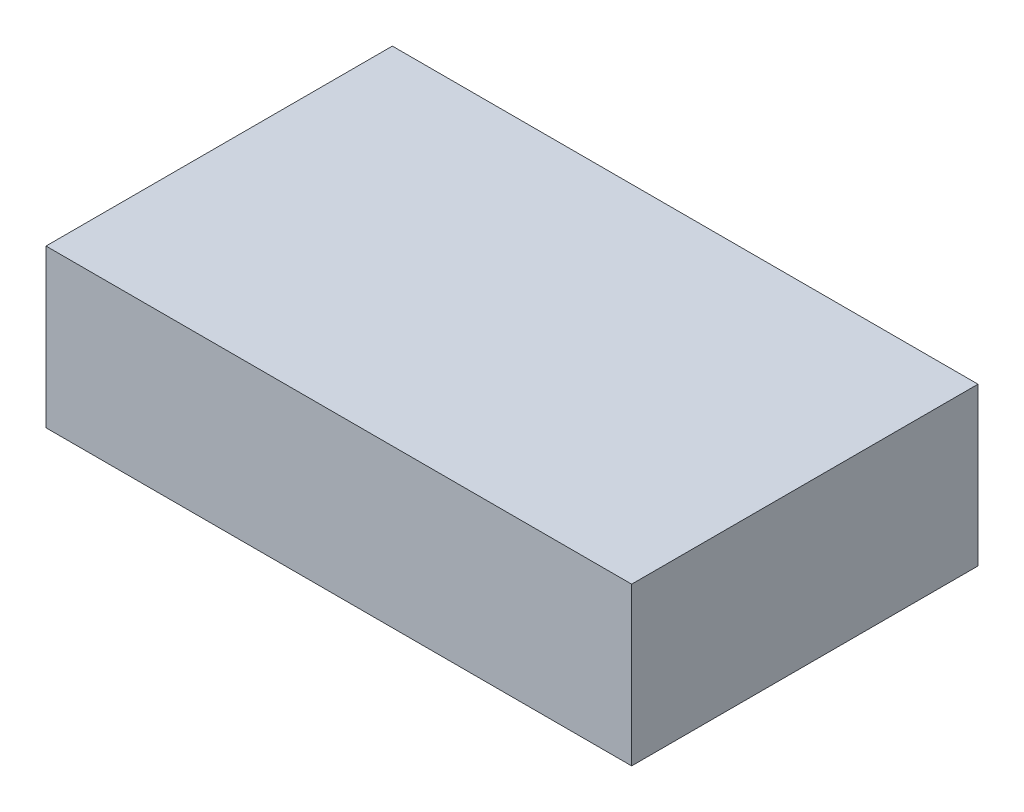
from build123d import *

# Parameters (mm, degrees)
SKETCH1_W           = 93
SKETCH1_H           = 55
BOSS_EXTRUDE1_DEPTH = 25
SHELL1_T            = -2


with BuildPart() as part:
    # Sketch1 → Boss-Extrude1 (new body)
    with BuildSketch(Plane(origin=(0, 0, 0), x_dir=(1, 0, 0), z_dir=(0, 1, 0))):
        with Locations((46.5, 27.5)):
            Rectangle(SKETCH1_W, SKETCH1_H)
    extrude(amount=BOSS_EXTRUDE1_DEPTH)

    # Shell1
    shell1_openings = [part.faces().sort_by_distance(p)[0] for p in [
        (0, 12.5, -27.5),
    ]]
    offset(amount=SHELL1_T, openings=shell1_openings, kind=Kind.INTERSECTION)


solid = part.part
